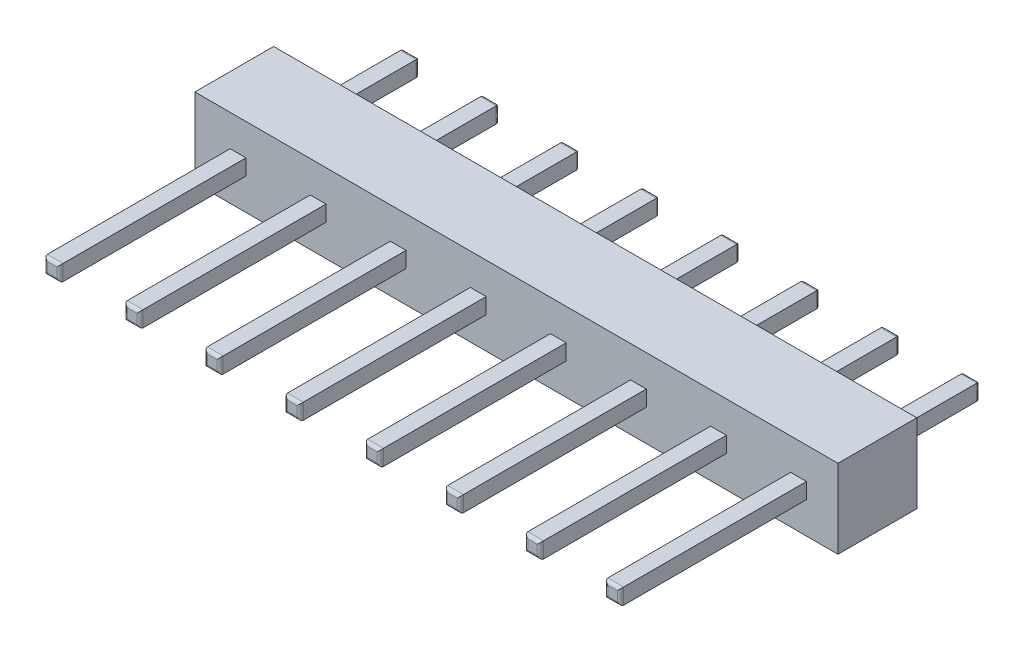
from build123d import *

# Parameters (mm, degrees)
SKETCH1_W              = 20.4
SKETCH1_H              = 2.5
BOSS_EXTRUDE1_DEPTH    = 2.5
SKETCH2_W              = 0.5
SKETCH2_H              = 0.5
BOSS_EXTRUDE2_DEPTH    = 5.9
FILLET1_R              = 0.1
LPATTERN1_COUNT        = 8
LPATTERN1_PITCH        = 2.54
FILLET1_OF_LPATTERN1_R = 0.1
SKETCH4_W              = 0.5
SKETCH4_H              = 0.5
BOSS_EXTRUDE3_DEPTH    = 3
FILLET2_R              = 0.1
LPATTERN2_COUNT        = 8
LPATTERN2_PITCH        = 2.54
FILLET2_OF_LPATTERN2_R = 0.1


with BuildPart() as part:
    # Sketch1 → Boss-Extrude1 (new body)
    with BuildSketch(Plane.XY):
        Rectangle(SKETCH1_W, SKETCH1_H)
    extrude(amount=BOSS_EXTRUDE1_DEPTH)

    # Sketch2 → Boss-Extrude2 (add)
    with BuildSketch(Plane.XY.offset(2.5)):
        with Locations((8.95, 0)):
            Rectangle(SKETCH2_W, SKETCH2_H)
    boss_extrude2 = extrude(amount=BOSS_EXTRUDE2_DEPTH)

    # Fillet1
    fillet1_edges = [part.edges().sort_by_distance(p)[0] for p in [
        (9.2, 0, 8.4),
        (8.95, 0.25, 8.4),
        (8.7, 0, 8.4),
        (8.95, -0.25, 8.4),
    ]]
    fillet(fillet1_edges, radius=FILLET1_R)

    # LPattern1: Boss-Extrude2 ×8
    with Locations(*[(-i * LPATTERN1_PITCH, 0, 0) for i in range(1, LPATTERN1_COUNT)]):
        add(boss_extrude2)

    # Fillet1 of LPattern1
    fillet1_of_lpattern1_edges = [part.edges().sort_by_distance(p)[0] for p in [
        (6.66, 0, 8.4),
        (6.41, 0.25, 8.4),
        (6.16, 0, 8.4),
        (6.41, -0.25, 8.4),
        (4.12, 0, 8.4),
        (3.87, 0.25, 8.4),
        (3.62, 0, 8.4),
        (3.87, -0.25, 8.4),
        (1.58, 0, 8.4),
        (1.33, 0.25, 8.4),
        (1.08, 0, 8.4),
        (1.33, -0.25, 8.4),
        (-0.96, 0, 8.4),
        (-1.21, 0.25, 8.4),
        (-1.46, 0, 8.4),
        (-1.21, -0.25, 8.4),
        (-3.5, 0, 8.4),
        (-3.75, 0.25, 8.4),
        (-4, 0, 8.4),
        (-3.75, -0.25, 8.4),
        (-6.04, 0, 8.4),
        (-6.29, 0.25, 8.4),
        (-6.54, 0, 8.4),
        (-6.29, -0.25, 8.4),
        (-8.58, 0, 8.4),
        (-8.83, 0.25, 8.4),
        (-9.08, 0, 8.4),
        (-8.83, -0.25, 8.4),
    ]]
    fillet(fillet1_of_lpattern1_edges, radius=FILLET1_OF_LPATTERN1_R)

    # Sketch4 → Boss-Extrude3 (add)
    with BuildSketch(Plane(origin=(0, 0, 0), x_dir=(-1, 0, 0), z_dir=(0, 0, -1))):
        with Locations((-8.95, 0)):
            Rectangle(SKETCH4_W, SKETCH4_H)
    boss_extrude3 = extrude(amount=BOSS_EXTRUDE3_DEPTH)

    # Fillet2
    fillet2_edges = [part.edges().sort_by_distance(p)[0] for p in [
        (8.95, 0.25, -3),
        (9.2, 0, -3),
        (8.95, -0.25, -3),
        (8.7, 0, -3),
    ]]
    fillet(fillet2_edges, radius=FILLET2_R)

    # LPattern2: Boss-Extrude3 ×8
    with Locations(*[(-i * LPATTERN2_PITCH, 0, 0) for i in range(1, LPATTERN2_COUNT)]):
        add(boss_extrude3)

    # Fillet2 of LPattern2
    fillet2_of_lpattern2_edges = [part.edges().sort_by_distance(p)[0] for p in [
        (6.41, 0.25, -3),
        (6.66, 0, -3),
        (6.41, -0.25, -3),
        (6.16, 0, -3),
        (3.87, 0.25, -3),
        (4.12, 0, -3),
        (3.87, -0.25, -3),
        (3.62, 0, -3),
        (1.33, 0.25, -3),
        (1.58, 0, -3),
        (1.33, -0.25, -3),
        (1.08, 0, -3),
        (-1.21, 0.25, -3),
        (-0.96, 0, -3),
        (-1.21, -0.25, -3),
        (-1.46, 0, -3),
        (-3.75, 0.25, -3),
        (-3.5, 0, -3),
        (-3.75, -0.25, -3),
        (-4, 0, -3),
        (-6.29, 0.25, -3),
        (-6.04, 0, -3),
        (-6.29, -0.25, -3),
        (-6.54, 0, -3),
        (-8.83, 0.25, -3),
        (-8.58, 0, -3),
        (-8.83, -0.25, -3),
        (-9.08, 0, -3),
    ]]
    fillet(fillet2_of_lpattern2_edges, radius=FILLET2_OF_LPATTERN2_R)


solid = part.part
